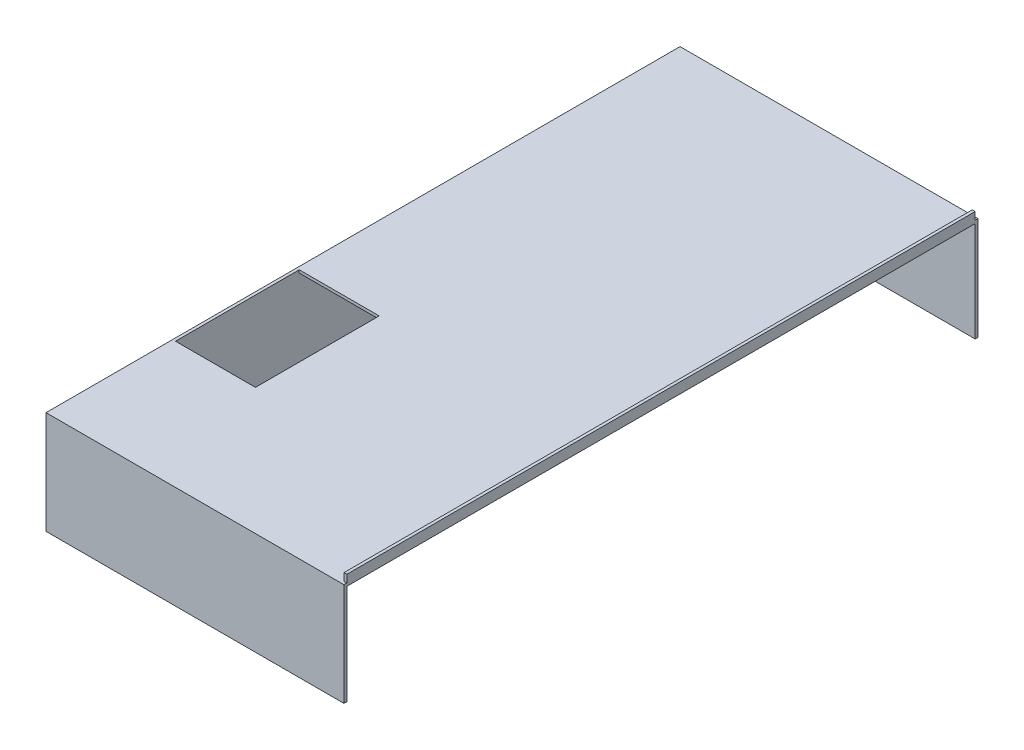
from build123d import *

# Parameters (mm, degrees)
BOSS_EXTRUDE4_DEPTH  = 1.5
SKETCH5_W            = 155
SKETCH5_H            = 54
BOSS_EXTRUDE5_DEPTH  = 1.5
SKETCH8_W            = 1.5
SKETCH8_H            = 330
BOSS_EXTRUDE14_DEPTH = 4
SKETCH7_W            = 155
SKETCH7_H            = 54
BOSS_EXTRUDE18_DEPTH = 1.5
SKETCH9_W            = 333
SKETCH9_H            = 54
BOSS_EXTRUDE19_DEPTH = 1.5


with BuildPart() as part:
    # Sketch4 → Boss-Extrude4 (new body)
    with BuildSketch(Plane(origin=(0, 0, 0), x_dir=(1, 0, 0), z_dir=(0, 1, 0))):
        Polygon((189.373653762, 330), (344.373653762, 330), (344.373653762, 0), (189.373653762, 0), (189.373653762, 65), (231.373653762, 65), (231.373653762, 130), (189.373653762, 130), align=None)
    extrude(amount=BOSS_EXTRUDE4_DEPTH)

    # Sketch5 → Boss-Extrude5 (add)
    with BuildSketch(Plane.XY):
        with Locations((266.873653762, -25.5)):
            Rectangle(SKETCH5_W, SKETCH5_H)
    extrude(amount=BOSS_EXTRUDE5_DEPTH)

    # Sketch8 → Boss-Extrude14 (add)
    with BuildSketch(Plane(origin=(0, 1.5, 0), x_dir=(1, 0, 0), z_dir=(0, 1, 0))):
        with Locations((343.623653762, 165)):
            Rectangle(SKETCH8_W, SKETCH8_H)
    extrude(amount=BOSS_EXTRUDE14_DEPTH)

    # Sketch7 → Boss-Extrude18 (add)
    with BuildSketch(Plane(origin=(0, 0, -330), x_dir=(-1, 0, 0), z_dir=(0, 0, -1))):
        with Locations((-266.873653762, -25.5)):
            Rectangle(SKETCH7_W, SKETCH7_H)
    extrude(amount=BOSS_EXTRUDE18_DEPTH)

    # Sketch9 → Boss-Extrude19 (add)
    with BuildSketch(Plane.ZY.offset(-189.373653762)):
        with Locations((-165, -25.5)):
            Rectangle(SKETCH9_W, SKETCH9_H)
    extrude(amount=BOSS_EXTRUDE19_DEPTH)


solid = part.part
